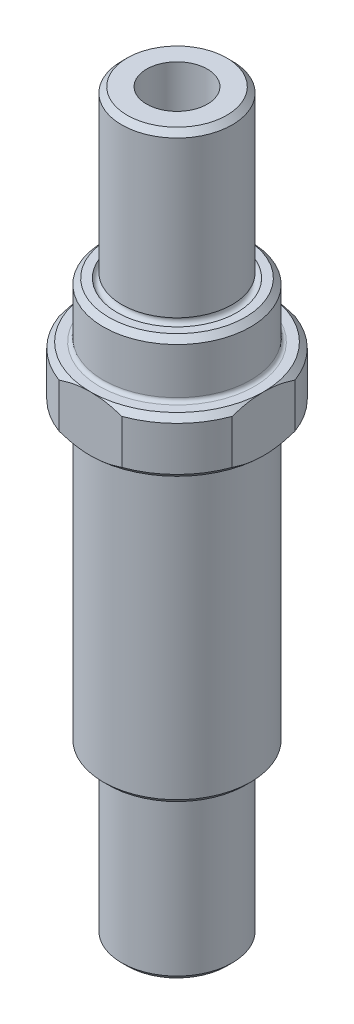
from build123d import *

# Parameters (mm, degrees)
SKETCH2_R                 = 0.25
CHAMFER1_SIZE             = 0.3
FILLET1_R                 = 0.2
M4X0_7_TAPPED_HOLE1_D     = 3.3
M4X0_7_TAPPED_HOLE1_DEPTH = 10
M4X0_7_TAPPED_HOLE1_TIP   = 0.991420021
M4X0_7_TAPPED_HOLE2_D     = 3.3
M4X0_7_TAPPED_HOLE2_DEPTH = 10
M4X0_7_TAPPED_HOLE2_TIP   = 0.991420021
CUT_EXTRUDE1_DEPTH        = 42.278632745
CIRPATTERN1_COUNT         = 4


with BuildPart() as part:
    # Sketch1 → Revolve1 (revolve)
    with BuildSketch(Plane.XY, mode=Mode.PRIVATE) as revolve1_sk:
        Polygon((27.464219092, 25), (27.464219092, -15), (24.464219092, -15), (24.464219092, -6), (23.464219092, -6), (23.464219092, 10), (22.464219092, 10), (22.464219092, 13), (23.464219092, 13), (23.464219092, 16), (24.464219092, 16), (24.464219092, 25), align=None)
    revolve(revolve1_sk.sketch.rotate(Axis((27.464219092, 25, 0), (0, -1, 0)), 270), axis=Axis((27.464219092, 25, 0), (0, -1, 0)))

    # Sketch2 → Cut-Revolve1 (revolve, cut)
    with BuildSketch(Plane.XY, mode=Mode.PRIVATE) as cut_revolve1_sk:
        with Locations((24.464219092, -6)):
            Circle(SKETCH2_R)
        with Locations((23.464219092, 10)):
            Circle(SKETCH2_R)
        with Locations((24.464219092, 16)):
            Circle(SKETCH2_R)
    revolve(cut_revolve1_sk.sketch.rotate(Axis((27.464219092, 25, 0), (0, -1, 0)), 270), axis=Axis((27.464219092, 25, 0), (0, -1, 0)), mode=Mode.SUBTRACT)

    # Chamfer1
    chamfer1_edges = [part.edges().sort_by_distance(p)[0] for p in [
        (27.464219092, 16, -4),
        (27.464219092, 13, -5),
        (27.464219092, 10, -5),
        (27.464219092, -6, -4),
        (27.464219092, -15, -3),
        (27.464219092, 25, -3),
    ]]
    chamfer(chamfer1_edges, length=CHAMFER1_SIZE)

    # Fillet1
    fillet1_edges = [part.edges().sort_by_distance(p)[0] for p in [
        (27.464219092, 13, -4),
    ]]
    fillet(fillet1_edges, radius=FILLET1_R)

    # M4x0.7 Tapped Hole1
    with Locations(Plane(origin=(0, 25, 0), x_dir=(1, 0, 0), z_dir=(0, 1, 0))):
        with Locations((27.464219092, 0)):
            Hole(M4X0_7_TAPPED_HOLE1_D / 2, depth=M4X0_7_TAPPED_HOLE1_DEPTH)
            with Locations((0, 0, -(M4X0_7_TAPPED_HOLE1_DEPTH + M4X0_7_TAPPED_HOLE1_TIP / 2))):  # 118° drill point
                Cone(0, M4X0_7_TAPPED_HOLE1_D / 2, M4X0_7_TAPPED_HOLE1_TIP, mode=Mode.SUBTRACT)

    # M4x0.7 Tapped Hole2
    with Locations(Plane(origin=(0, -15, 0), x_dir=(-1, 0, 0), z_dir=(0, -1, 0))):
        with Locations((-27.464219092, 0)):
            Hole(M4X0_7_TAPPED_HOLE2_D / 2, depth=M4X0_7_TAPPED_HOLE2_DEPTH)
            with Locations((0, 0, -(M4X0_7_TAPPED_HOLE2_DEPTH + M4X0_7_TAPPED_HOLE2_TIP / 2))):  # 118° drill point
                Cone(0, M4X0_7_TAPPED_HOLE2_D / 2, M4X0_7_TAPPED_HOLE2_TIP, mode=Mode.SUBTRACT)

    # Sketch8 → Cut-Extrude1 (cut, symmetric)
    with BuildSketch(Plane.XY):
        Polygon((22.764219092, 13), (22.764219092, 10), (22.464219092, 10.3), (22.464219092, 12.7), align=None)
        Polygon((32.164219092, 13), (32.164219092, 10), (32.464219092, 10.3), (32.464219092, 12.7), align=None)
    cut_extrude1 = extrude(amount=CUT_EXTRUDE1_DEPTH, both=True, mode=Mode.SUBTRACT)

    # CirPattern1: Cut-Extrude1 ×4 about axis
    cirpattern1_axis = Axis((27.464219092, 12.7, 0), (0, 1, 0))
    for i in range(1, CIRPATTERN1_COUNT):
        add(cut_extrude1.rotate(cirpattern1_axis, i * 360 / CIRPATTERN1_COUNT), mode=Mode.SUBTRACT)


solid = part.part
